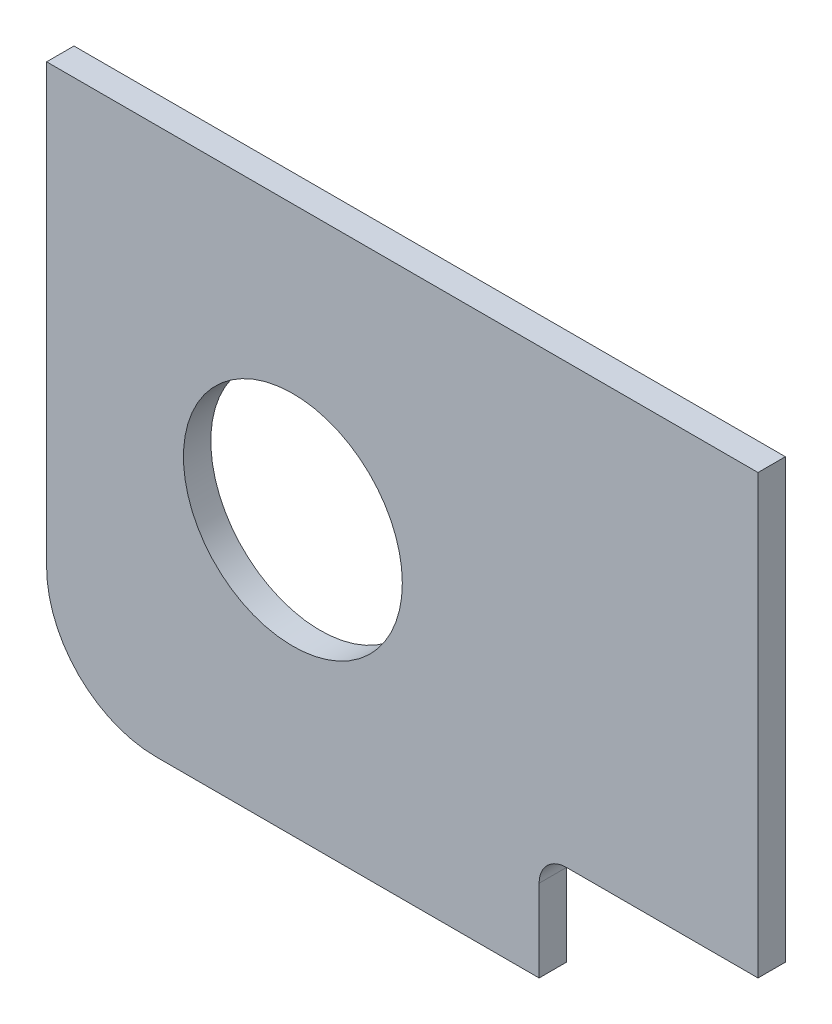
from build123d import *

# Parameters (mm, degrees)
SKIZZE1_R                       = 20
AUFSATZ_LINEAR_AUSTRAGEN1_DEPTH = 5


with BuildPart() as part:
    # Skizze1 → Aufsatz-Linear austragen1 (new body)
    with BuildSketch(Plane.XY):
        with BuildLine():
            Line((20, 0), (90, 0))
            Line((90, 0), (90, 15))
            ThreePointArc((90, 15), (91.464466094, 18.535533906), (95, 20))
            Line((95, 20), (130, 20))
            Line((130, 20), (130, 100))
            Line((130, 100), (0, 100))
            Line((0, 100), (0, 20))
            ThreePointArc((0, 20), (5.857864376, 5.857864376), (20, 0))
        make_face()
        with Locations((45, 50)):
            Circle(SKIZZE1_R, mode=Mode.SUBTRACT)
    extrude(amount=AUFSATZ_LINEAR_AUSTRAGEN1_DEPTH)


solid = part.part
